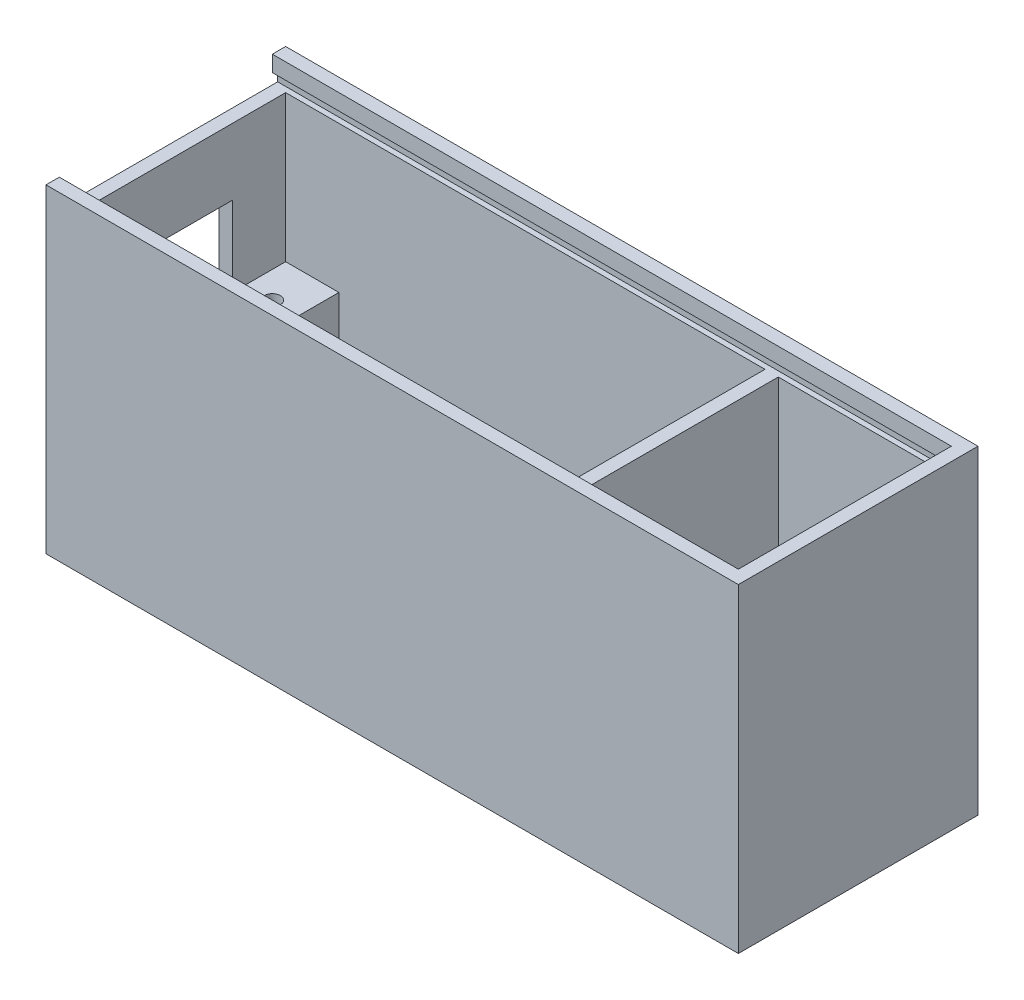
from build123d import *

# Parameters (mm, degrees)
SKETCH1_W           = 130
SKETCH1_H           = 45
BOSS_EXTRUDE1_DEPTH = 60
SHELL3_T            = -2.5
SKETCH4_W           = 2.5
SKETCH4_H           = 40
BOSS_EXTRUDE2_DEPTH = 57.5
SKETCH5_W           = 13
SKETCH5_H           = 40
BOSS_EXTRUDE3_DEPTH = 35
SKETCH6_W           = 20
SKETCH6_H           = 40
BOSS_EXTRUDE4_DEPTH = 20
SKETCH7_W           = 10
SKETCH7_H           = 40
BOSS_EXTRUDE5_DEPTH = 25
SKETCH9_R           = 1.5
CUT_EXTRUDE1_DEPTH  = 27.5
SKETCH11_R          = 1.5
CUT_EXTRUDE2_DEPTH  = 37.5
SKETCH16_W          = 20
SKETCH16_H          = 15
CUT_EXTRUDE3_DEPTH  = 2.5
SKETCH18_W          = 15
SKETCH18_H          = 10
CUT_EXTRUDE4_DEPTH  = 22.5
SKETCH19_W          = 40
SKETCH19_H          = 5
CUT_EXTRUDE5_DEPTH  = 2.5
SKETCH20_W          = 40
SKETCH20_H          = 5
CUT_EXTRUDE6_DEPTH  = 2.5
SKETCH21_R          = 3
CUT_EXTRUDE7_DEPTH  = 5
SKETCH22_W          = 127.5
SKETCH22_H          = 2
CUT_EXTRUDE8_DEPTH  = 1
SKETCH23_W          = 127.5
SKETCH23_H          = 2
CUT_EXTRUDE9_DEPTH  = 1


with BuildPart() as part:
    # Sketch1 → Boss-Extrude1 (new body)
    with BuildSketch(Plane(origin=(0, 0, 0), x_dir=(1, 0, 0), z_dir=(0, 1, 0))):
        Rectangle(SKETCH1_W, SKETCH1_H)
    extrude(amount=BOSS_EXTRUDE1_DEPTH)

    # Shell3
    shell3_openings = [part.faces().sort_by_distance(p)[0] for p in [
        (0, 60, 0),
    ]]
    offset(amount=SHELL3_T, openings=shell3_openings, kind=Kind.INTERSECTION)

    # Sketch4 → Boss-Extrude2 (add)
    with BuildSketch(Plane(origin=(0, 2.5, 0), x_dir=(1, 0, 0), z_dir=(0, 1, 0))):
        with Locations((28.75, 0)):
            Rectangle(SKETCH4_W, SKETCH4_H)
    extrude(amount=BOSS_EXTRUDE2_DEPTH)

    # Sketch5 → Boss-Extrude3 (add)
    with BuildSketch(Plane(origin=(0, 2.5, 0), x_dir=(1, 0, 0), z_dir=(0, 1, 0))):
        with Locations((56, 0)):
            Rectangle(SKETCH5_W, SKETCH5_H)
    extrude(amount=BOSS_EXTRUDE3_DEPTH)

    # Sketch6 → Boss-Extrude4 (add)
    with BuildSketch(Plane(origin=(0, 2.5, 0), x_dir=(1, 0, 0), z_dir=(0, 1, 0))):
        with Locations((17.5, 0)):
            Rectangle(SKETCH6_W, SKETCH6_H)
    extrude(amount=BOSS_EXTRUDE4_DEPTH)

    # Sketch7 → Boss-Extrude5 (add)
    with BuildSketch(Plane(origin=(0, 2.5, 0), x_dir=(1, 0, 0), z_dir=(0, 1, 0))):
        with Locations((-57.5, 0)):
            Rectangle(SKETCH7_W, SKETCH7_H)
    extrude(amount=BOSS_EXTRUDE5_DEPTH)

    # Sketch9 → Cut-Extrude1 (cut)
    with BuildSketch(Plane(origin=(0, 27.5, 0), x_dir=(1, 0, 0), z_dir=(0, 1, 0))):
        with Locations(Location((-57.5, 12.5, 0), (0, 0, 270))):
            Circle(SKETCH9_R)
        with Locations(Location((-57.5, -12.5, 0), (0, 0, 270))):
            Circle(SKETCH9_R)
    extrude(amount=-CUT_EXTRUDE1_DEPTH, mode=Mode.SUBTRACT)

    # Sketch11 → Cut-Extrude2 (cut)
    with BuildSketch(Plane(origin=(0, 37.5, 0), x_dir=(1, 0, 0), z_dir=(0, 1, 0))):
        with Locations(Location((56, 7.5, 0), (0, 0, 270))):
            Circle(SKETCH11_R)
        with Locations(Location((56, -7.5, 0), (0, 0, 270))):
            Circle(SKETCH11_R)
    extrude(amount=-CUT_EXTRUDE2_DEPTH, mode=Mode.SUBTRACT)

    # Sketch16 → Cut-Extrude3 (cut)
    with BuildSketch(Plane(origin=(-62.5, 0, 0), x_dir=(0, 0, -1), z_dir=(1, 0, 0))):
        with Locations((0, 35)):
            Rectangle(SKETCH16_W, SKETCH16_H)
    extrude(amount=-CUT_EXTRUDE3_DEPTH, mode=Mode.SUBTRACT)

    # Sketch18 → Cut-Extrude4 (cut)
    with BuildSketch(Plane.ZY.offset(-7.5)):
        with Locations((0, 7.5)):
            Rectangle(SKETCH18_W, SKETCH18_H)
    extrude(amount=-CUT_EXTRUDE4_DEPTH, mode=Mode.SUBTRACT)

    # Sketch19 → Cut-Extrude5 (cut)
    with BuildSketch(Plane(origin=(-62.5, 0, 0), x_dir=(0, 0, -1), z_dir=(1, 0, 0))):
        with Locations((0, 57.5)):
            Rectangle(SKETCH19_W, SKETCH19_H)
    extrude(amount=-CUT_EXTRUDE5_DEPTH, mode=Mode.SUBTRACT)

    # Sketch20 → Cut-Extrude6 (cut)
    with BuildSketch(Plane.ZY.offset(-27.5)):
        with Locations((0, 57.5)):
            Rectangle(SKETCH20_W, SKETCH20_H)
    extrude(amount=-CUT_EXTRUDE6_DEPTH, mode=Mode.SUBTRACT)

    # Sketch21 → Cut-Extrude7 (cut)
    with BuildSketch(Plane.XZ):
        with Locations(Location((56, -7.5, 0), (0, 0, 270))):
            Circle(SKETCH21_R)
        with Locations(Location((56, 7.5, 0), (0, 0, 270))):
            Circle(SKETCH21_R)
        with Locations(Location((-57.5, -12.5, 0), (0, 0, 270))):
            Circle(SKETCH21_R)
        with Locations(Location((-57.5, 12.5, 0), (0, 0, 270))):
            Circle(SKETCH21_R)
    extrude(amount=-CUT_EXTRUDE7_DEPTH, mode=Mode.SUBTRACT)

    # Sketch22 → Cut-Extrude8 (cut)
    with BuildSketch(Plane.XY.offset(-20)):
        with Locations((-1.25, 56)):
            Rectangle(SKETCH22_W, SKETCH22_H)
    extrude(amount=-CUT_EXTRUDE8_DEPTH, mode=Mode.SUBTRACT)

    # Sketch23 → Cut-Extrude9 (cut)
    with BuildSketch(Plane(origin=(0, 0, 20), x_dir=(-1, 0, 0), z_dir=(0, 0, -1))):
        with Locations((1.25, 56)):
            Rectangle(SKETCH23_W, SKETCH23_H)
    extrude(amount=-CUT_EXTRUDE9_DEPTH, mode=Mode.SUBTRACT)


solid = part.part
